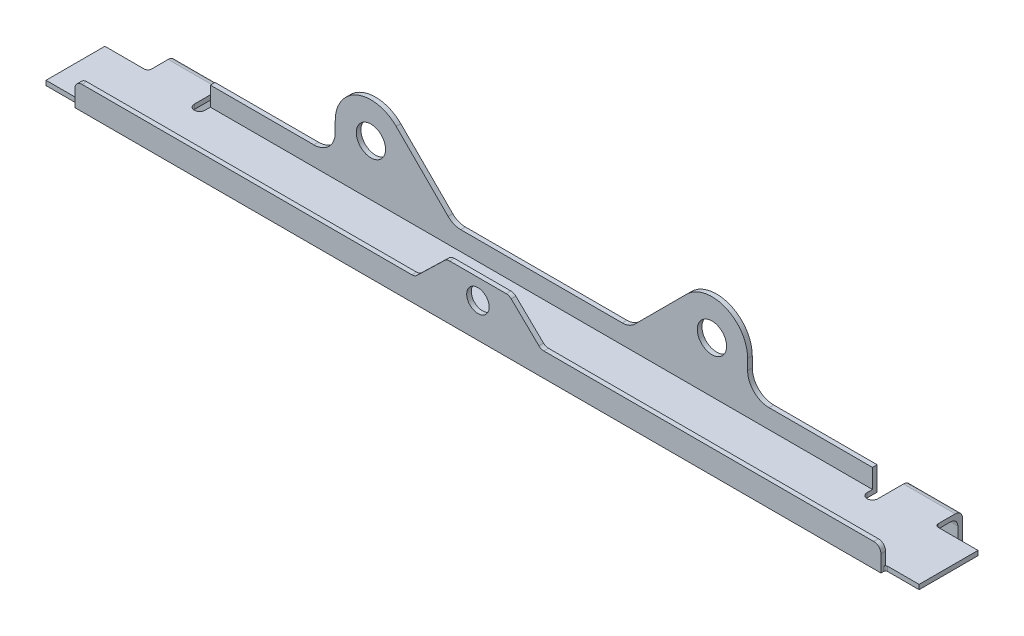
from build123d import *

# Parameters (mm, degrees)
BOSS_EXTRUDE1_DEPTH = 1.651
SKETCH2_W           = 18.415
SKETCH2_H           = 1.651
BOSS_EXTRUDE2_DEPTH = 10.287
FILLET1_R           = 2.54
FILLET3_R           = 1.27
SKETCH4_W           = 235.6739
SKETCH4_H           = 1.651
SKETCH4_W_2         = 286.8803
BOSS_EXTRUDE3_DEPTH = 30.861
SKETCH5_R           = 4.0005
CUT_EXTRUDE2_DEPTH  = 2.54
FILLET4_R           = 2.54
SKETCH11_R          = 5.207
CUT_EXTRUDE3_DEPTH  = 7.62


with BuildPart() as part:
    # Sketch1 → Boss-Extrude1 (new body)
    with BuildSketch(Plane(origin=(0, 0, 0), x_dir=(1, 0, 0), z_dir=(0, 1, 0))):
        with BuildLine():
            Line((117.83695, 8.5725), (117.83695, 12.1285))
            Line((117.83695, 12.1285), (117.186124302, 12.1285))
            Line((117.186124302, 12.1285), (-117.186124302, 12.1285))
            Line((-117.186124302, 12.1285), (-117.83695, 12.1285))
            Line((-117.83695, 12.1285), (-117.83695, 8.5725))
            ThreePointArc((-117.83695, 8.5725), (-119.74195, 6.6675), (-121.64695, 8.5725))
            Line((-121.64695, 8.5725), (-121.64695, 12.1285))
            Line((-121.64695, 12.1285), (-121.64695, 20.2565))
            Line((-121.64695, 20.2565), (-140.06195, 20.2565))
            Line((-140.06195, 20.2565), (-140.06195, 12.1285))
            Line((-140.06195, 12.1285), (-140.06195, 11.7475))
            ThreePointArc((-140.06195, 11.7475), (-140.433924388, 10.849474388), (-141.33195, 10.4775))
            Line((-141.33195, 10.4775), (-143.44015, 10.4775))
            Line((-143.44015, 10.4775), (-155.37815, 10.4775))
            Line((-155.37815, 10.4775), (-155.37815, -10.4775))
            Line((-155.37815, -10.4775), (-144.20215, -10.4775))
            ThreePointArc((-144.20215, -10.4775), (-143.663334633, -10.700684633), (-143.44015, -11.2395))
            Line((-143.44015, -11.2395), (-143.44015, -12.1285))
            Line((-143.44015, -12.1285), (143.44015, -12.1285))
            Line((143.44015, -12.1285), (143.44015, -11.2395))
            ThreePointArc((143.44015, -11.2395), (143.663334633, -10.700684633), (144.20215, -10.4775))
            Line((144.20215, -10.4775), (155.37815, -10.4775))
            Line((155.37815, -10.4775), (155.37815, 10.4775))
            Line((155.37815, 10.4775), (143.44015, 10.4775))
            Line((143.44015, 10.4775), (141.33195, 10.4775))
            ThreePointArc((141.33195, 10.4775), (140.433924388, 10.849474388), (140.06195, 11.7475))
            Line((140.06195, 11.7475), (140.06195, 12.1285))
            Line((140.06195, 12.1285), (140.06195, 20.2565))
            Line((140.06195, 20.2565), (121.64695, 20.2565))
            Line((121.64695, 20.2565), (121.64695, 12.1285))
            Line((121.64695, 12.1285), (121.64695, 8.5725))
            ThreePointArc((121.64695, 8.5725), (119.74195, 6.6675), (117.83695, 8.5725))
        make_face()
    extrude(amount=BOSS_EXTRUDE1_DEPTH)

    # Sketch2 → Boss-Extrude2 (add)
    with BuildSketch(Plane.XZ):
        with Locations((-130.85445, -19.431)):
            Rectangle(SKETCH2_W, SKETCH2_H)
        with Locations((130.85445, -19.431)):
            Rectangle(SKETCH2_W, SKETCH2_H)
    extrude(amount=BOSS_EXTRUDE2_DEPTH)

    # Fillet1
    fillet1_edges = [part.edges().sort_by_distance(p)[0] for p in [
        (130.85445, 1.651, -20.2565),
        (-130.85445, 1.651, -20.2565),
        (-130.85445, 0, -18.6055),
        (130.85445, 0, -18.6055),
    ]]
    fillet(fillet1_edges, radius=FILLET1_R)

    # Fillet3
    fillet3_edges = [part.edges().sort_by_distance(p)[0] for p in [
        (-140.06195, -10.287, -19.431),
        (-121.64695, -10.287, -19.431),
        (140.06195, -10.287, -19.431),
        (121.64695, -10.287, -19.431),
    ]]
    fillet(fillet3_edges, radius=FILLET3_R)

    # Sketch4 → Boss-Extrude3 (add)
    with BuildSketch(Plane(origin=(0, 1.651, 0), x_dir=(1, 0, 0), z_dir=(0, 1, 0))):
        with Locations((0, 11.303)):
            Rectangle(SKETCH4_W, SKETCH4_H)
        with Locations((0, -11.303)):
            Rectangle(SKETCH4_W_2, SKETCH4_H)
    extrude(amount=BOSS_EXTRUDE3_DEPTH)

    # Sketch5 → Cut-Extrude2 (cut)
    with BuildSketch(Plane.XY.offset(12.1285)):
        with Locations((0, 12.2555)):
            Circle(SKETCH5_R)
        Polygon((143.44015, 8.4582), (22.43455, 8.4582), (11.1125, 19.431), (-11.1125, 19.431), (-22.43455, 8.4582), (-143.44015, 8.4582), (-143.44015, 32.512), (143.44015, 32.512), align=None)
    extrude(amount=-CUT_EXTRUDE2_DEPTH, mode=Mode.SUBTRACT)

    # Fillet4
    fillet4_edges = [part.edges().sort_by_distance(p)[0] for p in [
        (143.44015, 8.4582, 11.303),
        (22.43455, 8.4582, 11.303),
        (11.1125, 19.431, 11.303),
        (-11.1125, 19.431, 11.303),
        (-22.43455, 8.4582, 11.303),
        (-143.44015, 8.4582, 11.303),
    ]]
    fillet(fillet4_edges, radius=FILLET4_R)

    # Sketch11 → Cut-Extrude3 (cut)
    with BuildSketch(Plane(origin=(0, 0, -12.1285), x_dir=(-1, 0, 0), z_dir=(0, 0, -1))):
        with Locations((60.68695, 19.812)):
            Circle(SKETCH11_R)
        with Locations((-60.68695, 19.812)):
            Circle(SKETCH11_R)
        with BuildLine():
            Line((81.00695, 8.4582), (117.83695, 8.4582))
            Line((117.83695, 8.4582), (117.83695, 32.512))
            Line((117.83695, 32.512), (60.68695, 32.512))
            ThreePointArc((60.68695, 32.512), (69.667206121, 28.792256121), (73.38695, 19.812))
            Line((73.38695, 19.812), (73.38695, 16.0782))
            ThreePointArc((73.38695, 16.0782), (75.618796327, 10.690046327), (81.00695, 8.4582))
        make_face()
        with BuildLine():
            Line((-28.742381637, 8.4582), (0, 8.4582))
            Line((0, 8.4582), (28.742381637, 8.4582))
            ThreePointArc((28.742381637, 8.4582), (31.172421432, 8.941564969), (33.232509697, 10.318071939))
            Line((33.232509697, 10.318071939), (51.706693879, 28.792256121))
            ThreePointArc((51.706693879, 28.792256121), (55.826870409, 31.545270063), (60.68695, 32.512))
            Line((60.68695, 32.512), (-60.68695, 32.512))
            ThreePointArc((-60.68695, 32.512), (-55.826870409, 31.545270063), (-51.706693879, 28.792256121))
            Line((-51.706693879, 28.792256121), (-33.232509697, 10.318071939))
            ThreePointArc((-33.232509697, 10.318071939), (-31.172421432, 8.941564969), (-28.742381637, 8.4582))
        make_face()
        with BuildLine():
            Line((-117.83695, 32.512), (-117.83695, 8.4582))
            Line((-117.83695, 8.4582), (-81.00695, 8.4582))
            ThreePointArc((-81.00695, 8.4582), (-75.618796327, 10.690046327), (-73.38695, 16.0782))
            Line((-73.38695, 16.0782), (-73.38695, 19.812))
            ThreePointArc((-73.38695, 19.812), (-69.667206121, 28.792256121), (-60.68695, 32.512))
            Line((-60.68695, 32.512), (-117.83695, 32.512))
        make_face()
    extrude(amount=-CUT_EXTRUDE3_DEPTH, mode=Mode.SUBTRACT)


solid = part.part
